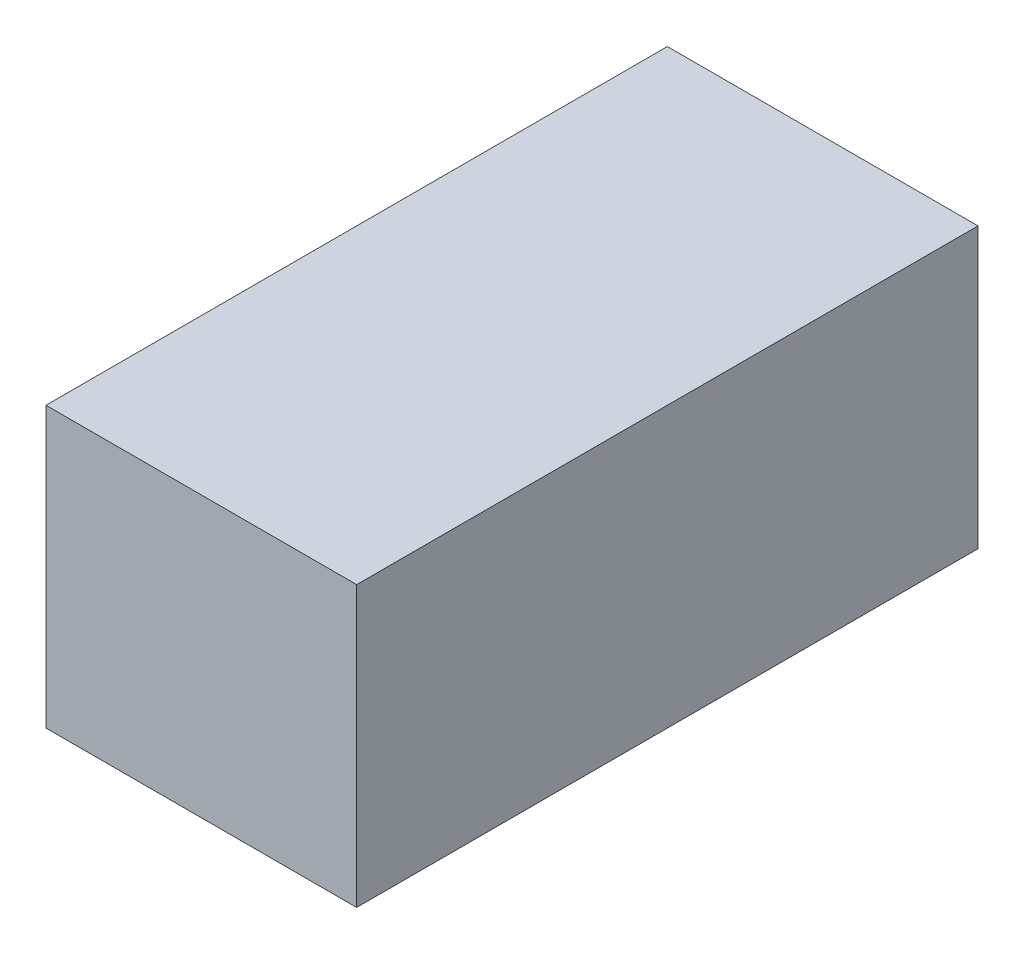
from build123d import *

# Parameters (mm, degrees)
SKETCH1_W           = 200
SKETCH1_H           = 180
BOSS_EXTRUDE1_DEPTH = 400


with BuildPart() as part:
    # Sketch1 → Boss-Extrude1 (new body)
    with BuildSketch(Plane.XY):
        Rectangle(SKETCH1_W, SKETCH1_H)
    extrude(amount=BOSS_EXTRUDE1_DEPTH)


solid = part.part
